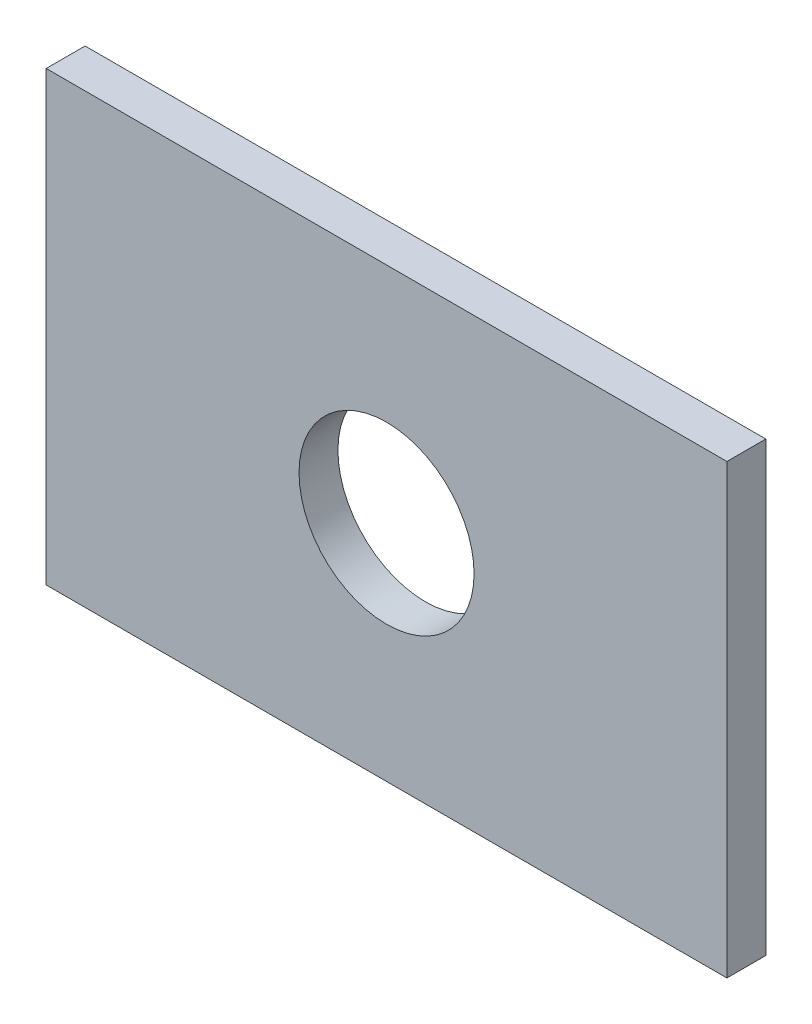
from build123d import *

# Parameters (mm, degrees)
SKETCH1_W           = 35
SKETCH1_H           = 23
SKETCH1_R           = 4.5
BOSS_EXTRUDE1_DEPTH = 2


with BuildPart() as part:
    # Sketch1 → Boss-Extrude1 (new body)
    with BuildSketch(Plane.XY):
        Rectangle(SKETCH1_W, SKETCH1_H)
        Circle(SKETCH1_R, mode=Mode.SUBTRACT)
    extrude(amount=BOSS_EXTRUDE1_DEPTH)


solid = part.part
